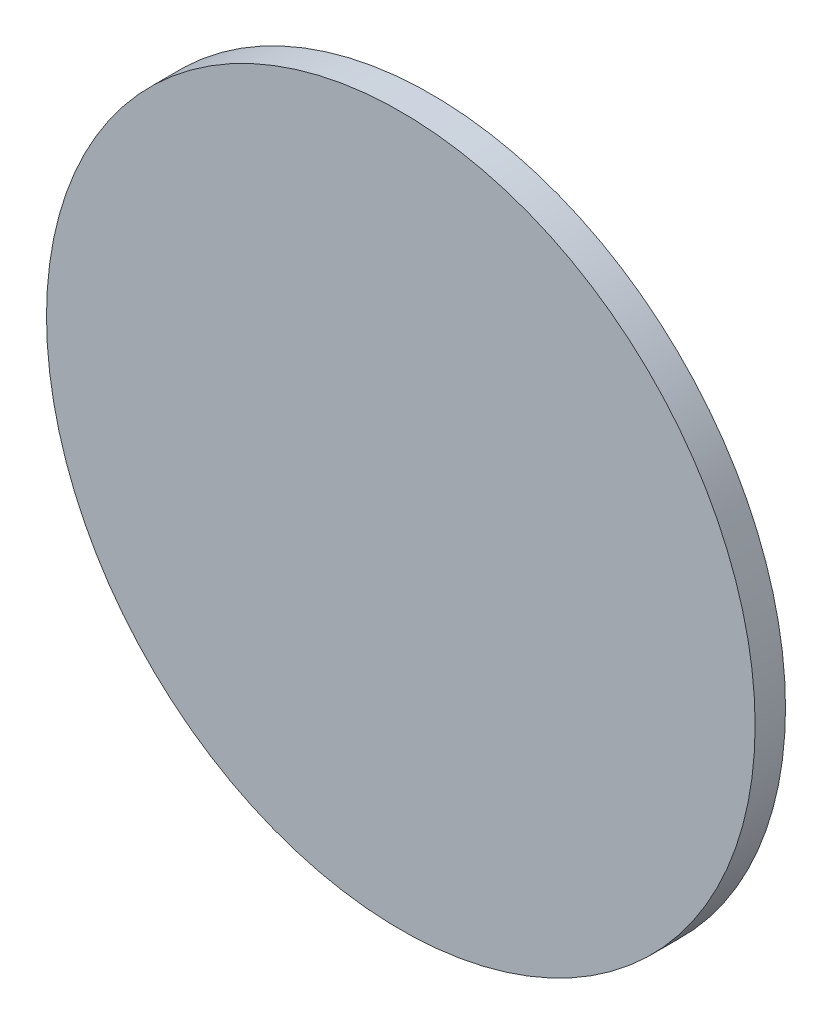
from build123d import *

# Parameters (mm, degrees)
SKETCH1_R           = 350
BOSS_EXTRUDE1_DEPTH = 30


with BuildPart() as part:
    # Sketch1 → Boss-Extrude1 (new body)
    with BuildSketch(Plane.XY):
        Circle(SKETCH1_R)
    extrude(amount=BOSS_EXTRUDE1_DEPTH)


solid = part.part
